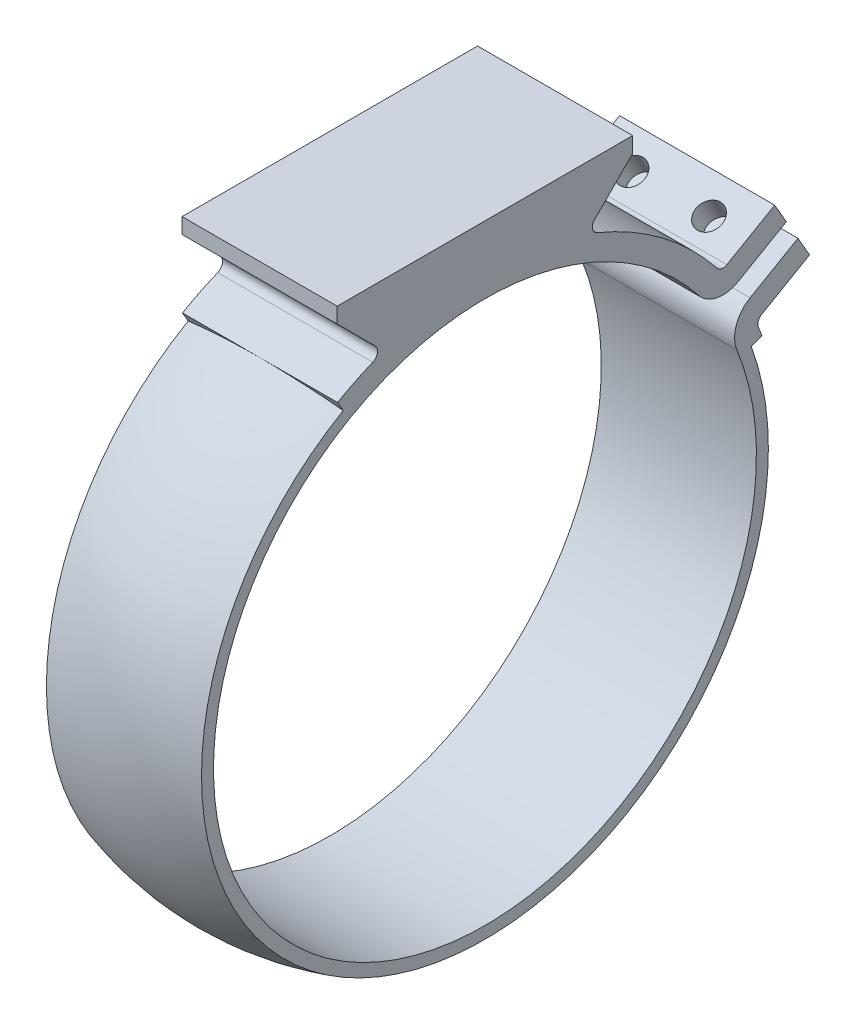
from build123d import *

# Parameters (mm, degrees)
BOSS_EXTRUDE1_DEPTH                          = 20
FILLET1_R                                    = 1
FILLET2_R                                    = 4
CSK_FOR_M3_COUNTERSUNK_FLAT_HEAD_SCR_2_COUNT = 2
CSK_FOR_M3_COUNTERSUNK_FLAT_HEAD_SCR_2_PITCH = 10
CUT_REVOLVE1_ANGLE                           = 110
CUT_REVOLVE1_OTHER_WAY_ANGLE                 = 150


with BuildPart() as part:
    # Sketch1 → Boss-Extrude1 (new body)
    with BuildSketch(Plane(origin=(0, 0, 0), x_dir=(0, 0, -1), z_dir=(1, 0, 0))):
        with BuildLine():
            Line((-19.05, 43.688898834), (19.05, 43.688898834))
            Line((19.05, 43.688898834), (19.05, 41.688898834))
            Line((19.05, 41.688898834), (13.05, 35.688898834))
            ThreePointArc((13.05, 35.688898834), (22.67902305, 30.490357714), (30.427400447, 22.763420262))
            Line((30.427400447, 22.763420262), (37.355603678, 26.763420262))
            Line((37.355603678, 26.763420262), (38.855603678, 24.16534405))
            Line((38.855603678, 24.16534405), (29.533039808, 18.782959291))
            ThreePointArc((29.533039808, 18.782959291), (-30.310889132, -17.5), (31.033039808, 16.184883079))
            Line((31.033039808, 16.184883079), (40.355603678, 21.567267839))
            Line((40.355603678, 21.567267839), (41.855603678, 18.969191628))
            Line((41.855603678, 18.969191628), (34.927400447, 14.969191628))
            ThreePointArc((34.927400447, 14.969191628), (-15.065912825, -34.885788951), (-13.05, 35.688898834))
            Line((-13.05, 35.688898834), (-19.05, 41.688898834))
            Line((-19.05, 41.688898834), (-19.05, 43.688898834))
        make_face()
    extrude(amount=BOSS_EXTRUDE1_DEPTH)

    # Fillet1
    fillet1_edges = [part.edges().sort_by_distance(p)[0] for p in [
        (10, 35.688898834, 13.05),
        (10, 35.688898834, -13.05),
        (10, 22.763420262, -30.427400447),
        (10, 14.969191628, -34.927400447),
    ]]
    fillet(fillet1_edges, radius=FILLET1_R)

    # Fillet2
    fillet2_edges = [part.edges().sort_by_distance(p)[0] for p in [
        (10, 18.782959291, -29.533039808),
        (10, 16.184883079, -31.033039808),
    ]]
    fillet(fillet2_edges, radius=FILLET2_R)

    # Sketch3 → CSK for M3 Countersunk Flat Head Screw1 (revolve, cut)
    with BuildSketch(Plane(origin=(15, 16.969191628, -38.391502063), x_dir=(0, 0.49999999999999817, -0.8660254037844398), z_dir=(1, 0, 0))):
        Polygon((0, 0), (0, 61.335696254), (1.7, 61.335696254), (1.7, 1.45), (3.15, 0), align=None)
    csk_for_m3_countersunk_flat_head_screw1 = revolve(axis=Axis((15, 11.469930314, -41.566502063), (0, 0.8660254037844398, 0.4999999999999981)), mode=Mode.SUBTRACT)

    # CSK for M3 Countersunk Flat Head Scr 2: CSK for M3 Countersunk Flat Head Screw1 ×2
    with Locations(*[(-i * CSK_FOR_M3_COUNTERSUNK_FLAT_HEAD_SCR_2_PITCH, 0, 0) for i in range(1, CSK_FOR_M3_COUNTERSUNK_FLAT_HEAD_SCR_2_COUNT)]):
        add(csk_for_m3_countersunk_flat_head_screw1, mode=Mode.SUBTRACT)

    # Sketch4 → Cut-Revolve1 (revolve, cut)
    with BuildSketch(Plane.XY):
        with BuildLine():
            Line((-8.002699019, -33.015043362), (-8.002699019, -46))
            Line((-8.002699019, -46), (28, -46))
            Line((28, -46), (28, -33.01666204))
            ThreePointArc((28, -33.01666204), (9.998426404, -37.999999965), (-8.002699019, -33.015043362))
        make_face()
    revolve(axis=Axis((-3.558727933, 0, 0), (1, 0, 0)), revolution_arc=CUT_REVOLVE1_ANGLE, mode=Mode.SUBTRACT)

    # Sketch4 → Cut-Revolve1 other way (revolve, cut)
    with BuildSketch(Plane.XY):
        with BuildLine():
            Line((-8.002699019, -33.015043362), (-8.002699019, -46))
            Line((-8.002699019, -46), (28, -46))
            Line((28, -46), (28, -33.01666204))
            ThreePointArc((28, -33.01666204), (9.998426404, -37.999999965), (-8.002699019, -33.015043362))
        make_face()
    revolve(axis=Axis((-3.558727933, 0, 0), (-1, 0, 0)), revolution_arc=CUT_REVOLVE1_OTHER_WAY_ANGLE, mode=Mode.SUBTRACT)


solid = part.part
